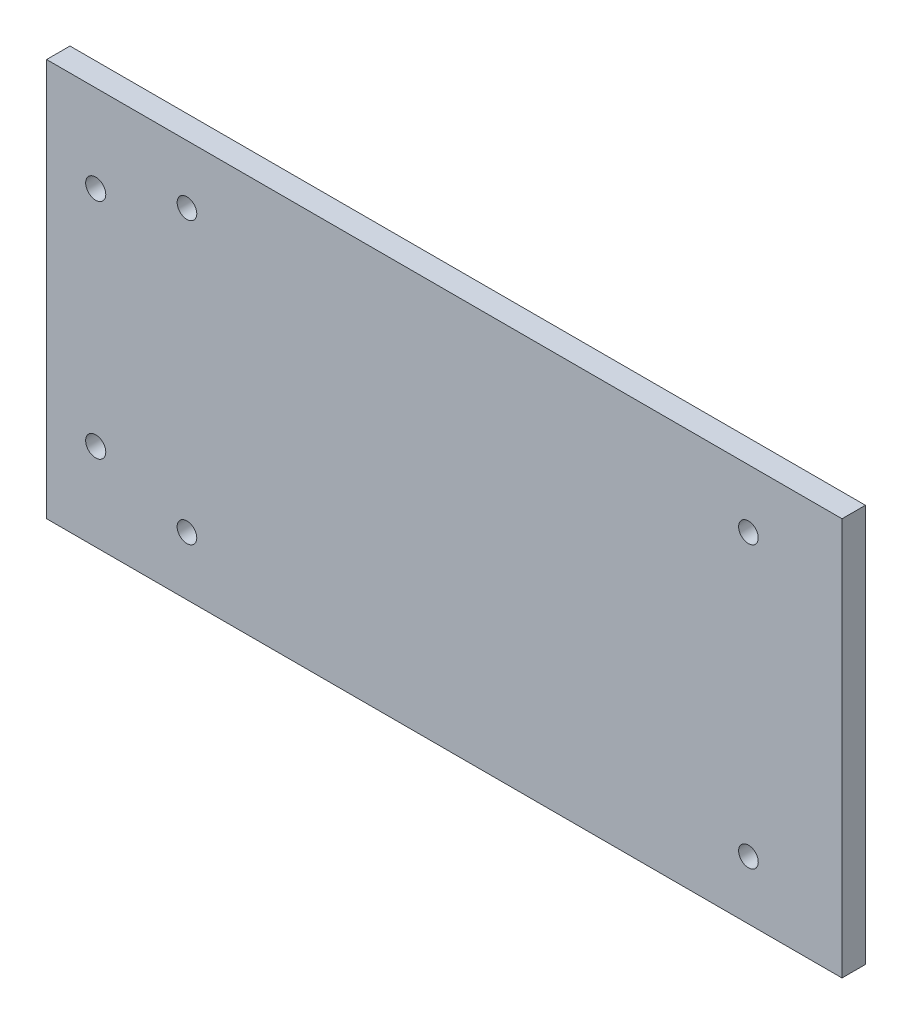
from build123d import *

# Parameters (mm, degrees)
SKETCH1_W           = 85
SKETCH1_H           = 170
SKETCH1_R           = 2.1
BOSS_EXTRUDE1_DEPTH = 5
SKETCH2_R           = 2.15
CUT_EXTRUDE1_DEPTH  = 10
SKETCH3_R           = 2.15
CUT_EXTRUDE2_DEPTH  = 10


with BuildPart() as part:
    # Sketch1 → Boss-Extrude1 (new body)
    with BuildSketch(Plane(origin=(0, 0, 0), x_dir=(0, 1, 0), z_dir=(0, 0, 1))):
        Rectangle(SKETCH1_W, SKETCH1_H)
        with Locations(Location((-30, 55, 0), (0, 0, 270))):
            Circle(SKETCH1_R, mode=Mode.SUBTRACT)
        with Locations(Location((-30, -65, 0), (0, 0, 270))):
            Circle(SKETCH1_R, mode=Mode.SUBTRACT)
        with Locations(Location((30, -65, 0), (0, 0, 90))):
            Circle(SKETCH1_R, mode=Mode.SUBTRACT)
        with Locations(Location((30, 55, 0), (0, 0, 90))):
            Circle(SKETCH1_R, mode=Mode.SUBTRACT)
    extrude(amount=BOSS_EXTRUDE1_DEPTH)

    # Sketch2 → Cut-Extrude1 (cut)
    with BuildSketch(Plane(origin=(0, 0, 5), x_dir=(0, -1, 0), z_dir=(0, 0, 1))):
        with Locations(Location((23.85, -74.5, 0), (0, 0, 90))):
            Circle(SKETCH2_R)
    extrude(amount=-CUT_EXTRUDE1_DEPTH, mode=Mode.SUBTRACT)

    # Sketch3 → Cut-Extrude2 (cut)
    with BuildSketch(Plane(origin=(0, 0, 5), x_dir=(0, -1, 0), z_dir=(0, 0, 1))):
        with Locations(Location((-23.85, -74.5, 0), (0, 0, 90))):
            Circle(SKETCH3_R)
    extrude(amount=-CUT_EXTRUDE2_DEPTH, mode=Mode.SUBTRACT)


solid = part.part
